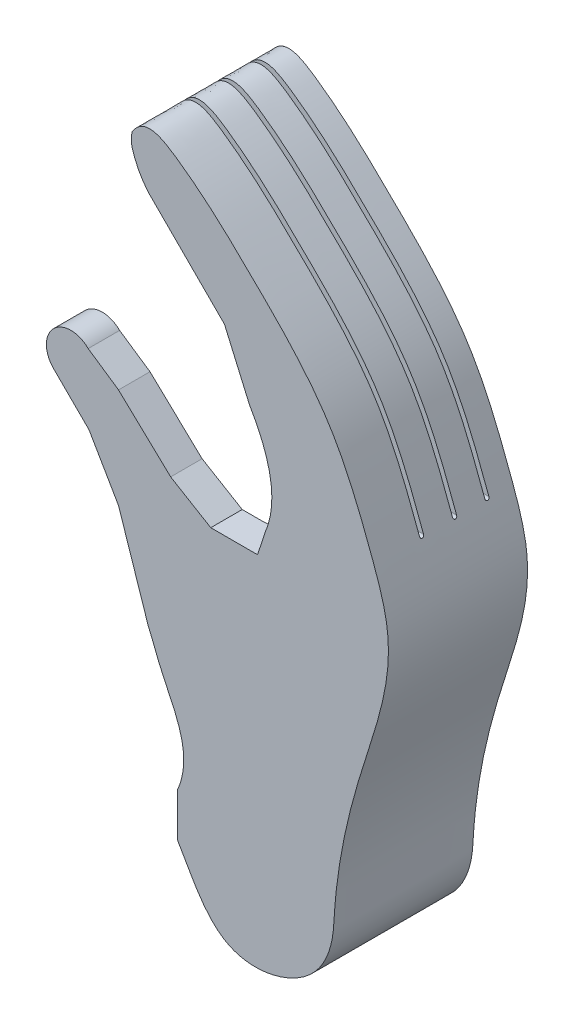
from build123d import *

# Parameters (mm, degrees)
BOSS_EXTRUDE1_DEPTH = 87.63
CUT_EXTRUDE1_DEPTH  = 67.818
CUT_EXTRUDE3_DEPTH  = 198.12
CUT_EXTRUDE5_DEPTH  = 79.248
FILLET2_R           = 12.7


with BuildPart() as part:
    # Sketch1 → Boss-Extrude1 (new body)
    with BuildSketch(Plane.XY):
        with BuildLine():
            Line((-32.480234715, -164.099713179), (-32.480234715, -136.208488823))
            add(Edge.make_bspline(
                [(-32.480234715, -136.208488823), (-21.651523278, -110.974476627), (-39.870572153, -87.774194641), (-48.828136874, -60.930474896), (-51.108001116, -56.000713426)],
                knots=[0, 0, 0, 0, 0.610193429, 0.759720903, 0.759720903, 0.759720903, 0.759720903], degree=3))
            Line((-51.108001116, -56.000713426), (-69.735767516, 0))
            Line((-69.735767516, 0), (-88.323507759, 32.026427771))
            Line((-88.323507759, 32.026427771), (-110.638603602, 54.217844304))
            ThreePointArc((-110.638603602, 54.217844304), (-110.656667932, 76.030892552), (-88.843619684, 76.048956883))
            Line((-88.843619684, 76.048956883), (-69.735759165, 63.080932943))
            Line((-69.735759165, 63.080932943), (-36.907960255, 32.026427771))
            Line((-36.907960255, 32.026427771), (-11.644361672, 16.960675957))
            Line((-11.644361672, 16.960675957), (17.826517719, 16.960675957))
            Line((17.826517719, 16.960675957), (22.753179607, 32.026427771))
            add(Edge.make_bspline(
                [(22.753179607, 32.026427771), (34.407372743, 59.77371599), (12.746305459, 96.180443217)],
                knots=[0, 0, 0, 1, 1, 1], degree=2))
            Line((12.746305459, 96.180443217), (-3.011156198, 132.263898557))
            Line((-3.011156198, 132.263898557), (-15.748325744, 145.001068103))
            Line((-15.748325744, 145.001068103), (-51.108001116, 180.360743474))
            ThreePointArc((-51.108001116, 180.360743474), (-57.060803787, 189.332738746), (-61.121301062, 199.304946159))
            ThreePointArc((-61.121301062, 199.304946159), (-61.647759349, 203.791731005), (-61.121301062, 208.278515851))
            add(Edge.make_bspline(
                [(-32.480234715, -164.099713179), (-24.525281216, -176.820665433), (-6.924099681, -218.855597672), (54.325246971, -203.435369729), (65.359556754, -171.963749114), (67.283585796, -130.143998929), (79.901763862, -70.553588837), (108.370423768, 0.641801773), (86.122031128, 62.452256944), (64.111489248, 117.340604431), (15.437454562, 165.678786757), (-21.873190995, 201.75531886), (-53.19799411, 220.787183241), (-61.121301062, 208.278515851)],
                knots=[0, 0, 0, 0, 0.089315503, 0.181585604, 0.234615905, 0.247738947, 0.393701066, 0.545482647, 0.610857249, 0.718681516, 0.844293426, 0.945226215, 1, 1, 1, 1], degree=3))
        make_face()
    extrude(amount=BOSS_EXTRUDE1_DEPTH)

    # Sketch2 → Cut-Extrude1 (cut)
    with BuildSketch(Plane.XY):
        with BuildLine():
            Line((17.826517719, 16.960675957), (-98.528669434, 121.111394666))
            Line((-98.528669434, 121.111394666), (-172.574988011, 58.265403339))
            Line((-172.574988011, 58.265403339), (-29.490181428, -109.545843986))
            ThreePointArc((-29.490181428, -109.545843986), (-18.088495683, -41.708275829), (17.826517719, 16.960675957))
        make_face()
    extrude(amount=CUT_EXTRUDE1_DEPTH, mode=Mode.SUBTRACT)

    # Sketch3 → Cut-Extrude3 (cut)
    with BuildSketch(Plane(origin=(0, 0, 0), x_dir=(0, 0, -1), z_dir=(1, 0, 0))):
        with BuildLine():
            Line((-37.846, 225.800229475), (-56.134, 225.800229475))
            Line((-56.134, 225.800229475), (-56.134, 48.883544805))
            ThreePointArc((-56.134, 48.883544805), (-57.404, 47.613544805), (-58.674, 48.883544805))
            Line((-58.674, 48.883544805), (-58.674, 244.616911716))
            Line((-58.674, 244.616911716), (-14.986, 244.616911716))
            Line((-14.986, 244.616911716), (-14.986, 225.800229475))
            Line((-14.986, 225.800229475), (-14.986, 48.883544805))
            ThreePointArc((-14.986, 48.883544805), (-16.256, 47.613544805), (-17.526, 48.883544805))
            Line((-17.526, 48.883544805), (-17.526, 225.800229475))
            Line((-17.526, 225.800229475), (-35.306, 225.800229475))
            Line((-35.306, 225.800229475), (-35.306, 48.883544805))
            ThreePointArc((-35.306, 48.883544805), (-36.576, 47.613544805), (-37.846, 48.883544805))
            Line((-37.846, 48.883544805), (-37.846, 225.800229475))
        make_face()
    extrude(amount=CUT_EXTRUDE3_DEPTH, mode=Mode.SUBTRACT)

    # Sketch5 → Cut-Extrude5 (cut)
    with BuildSketch(Plane(origin=(0, 0, 0), x_dir=(0, 0, -1), z_dir=(1, 0, 0))):
        Polygon((-14.986, 244.616911716), (-58.674, 244.616911716), (-58.674, 85.159504071), (-56.134, 85.159504071), (-56.134, 225.800229475), (-37.846, 225.800229475), (-37.846, 85.159504071), (-35.306, 85.159504071), (-35.306, 225.800229475), (-17.526, 225.800229475), (-17.526, 85.159504071), (-14.986, 85.159504071), align=None)
    extrude(amount=-CUT_EXTRUDE5_DEPTH, mode=Mode.SUBTRACT)

    # Fillet2
    fillet2_edges = [part.edges().sort_by_distance(p)[0] for p in [
        (-18.088495683, -41.708275829, 67.818),
    ]]
    fillet(fillet2_edges, radius=FILLET2_R)


solid = part.part
